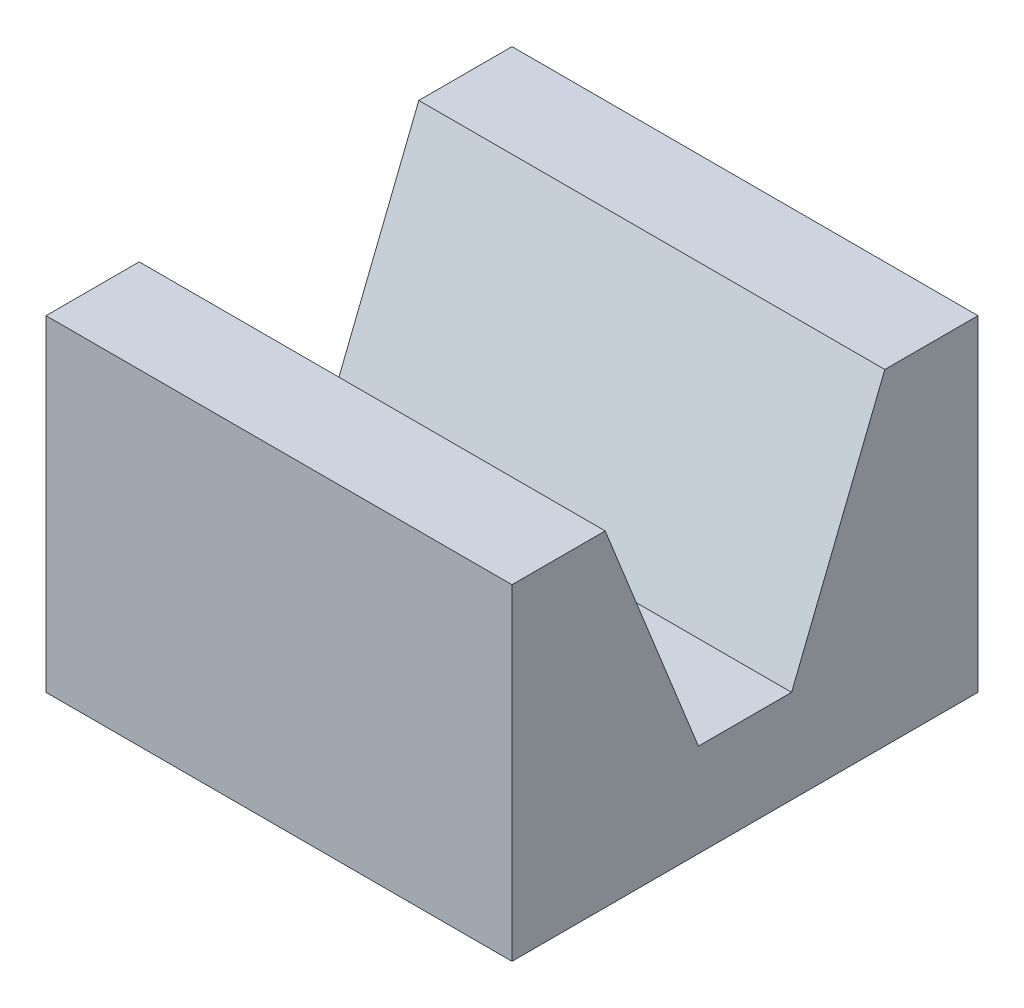
from build123d import *

# Parameters (mm, degrees)
SKETCH1_W           = 50
SKETCH1_H           = 70
BOSS_EXTRUDE1_DEPTH = 100
CUT_EXTRUDE1_DEPTH  = 100


with BuildPart() as part:
    # Sketch1 → Boss-Extrude1 (new body)
    with BuildSketch(Plane(origin=(0, 0, 0), x_dir=(0, 0, -1), z_dir=(1, 0, 0))):
        with Locations((25, 35)):
            Rectangle(SKETCH1_W, SKETCH1_H)
    extrude(amount=BOSS_EXTRUDE1_DEPTH)

    # Sketch2 → Cut-Extrude1 (cut)
    with BuildSketch(Plane(origin=(100, 0, 0), x_dir=(0, 0, -1), z_dir=(1, 0, 0))):
        Polygon((0, 70), (30, 70), (10, 20), (0, 20), align=None)
    extrude(amount=-CUT_EXTRUDE1_DEPTH, mode=Mode.SUBTRACT)

    # Mirror1: part across plane


with BuildPart() as part_1:
    add(part.part)
    add(part.part.mirror(Plane.XY))


solid = part_1.part
